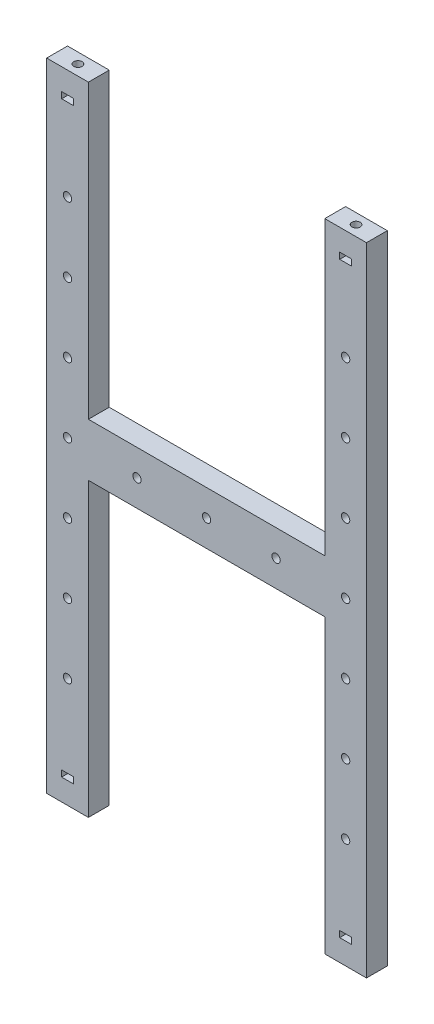
from build123d import *

# Parameters (mm, degrees)
SKETCH_1_R               = 3
EXTRUDE_1_DEPTH          = 15
SKETCH_2_R               = 3
CUT_EXTRUDE_1_DEPTH      = 30
MIRROR_2_COPY_1_SKETCH_R = 3
MIRROR_2_COPY_1_DEPTH    = 30
CUT_EXTRUDE_2_DEPTH      = 4.5
MIRROR_4_COPY_1_DEPTH    = 4.5


with BuildPart() as part:
    # 草图1 → 凸台-拉伸1 (new body)
    with BuildSketch(Plane.XY):
        Polygon((-115, 229), (-115, -229), (-85, -229), (-85, -19), (85, -19), (85, -229), (115, -229), (115, 229), (85, 229), (85, 19), (-85, 19), (-85, 229), align=None)
        Circle(SKETCH_1_R, mode=Mode.SUBTRACT)
        with Locations((50, 0)):
            Circle(SKETCH_1_R, mode=Mode.SUBTRACT)
        with Locations((100, 0)):
            Circle(SKETCH_1_R, mode=Mode.SUBTRACT)
        with Locations((-50, 0)):
            Circle(SKETCH_1_R, mode=Mode.SUBTRACT)
        with Locations((-100, 0)):
            Circle(SKETCH_1_R, mode=Mode.SUBTRACT)
        with Locations((100, 50)):
            Circle(SKETCH_1_R, mode=Mode.SUBTRACT)
        with Locations((100, 100)):
            Circle(SKETCH_1_R, mode=Mode.SUBTRACT)
        with Locations((100, 150)):
            Circle(SKETCH_1_R, mode=Mode.SUBTRACT)
        with Locations((-100, -50)):
            Circle(SKETCH_1_R, mode=Mode.SUBTRACT)
        with Locations((-100, -100)):
            Circle(SKETCH_1_R, mode=Mode.SUBTRACT)
        with Locations((-100, -150)):
            Circle(SKETCH_1_R, mode=Mode.SUBTRACT)
        with Locations((100, -50)):
            Circle(SKETCH_1_R, mode=Mode.SUBTRACT)
        with Locations((100, -100)):
            Circle(SKETCH_1_R, mode=Mode.SUBTRACT)
        with Locations((100, -150)):
            Circle(SKETCH_1_R, mode=Mode.SUBTRACT)
        with Locations((-100, 50)):
            Circle(SKETCH_1_R, mode=Mode.SUBTRACT)
        with Locations((-100, 100)):
            Circle(SKETCH_1_R, mode=Mode.SUBTRACT)
        with Locations((-100, 150)):
            Circle(SKETCH_1_R, mode=Mode.SUBTRACT)
    extrude(amount=EXTRUDE_1_DEPTH)

    # 草图2 → 切除-拉伸1 (cut)
    with BuildSketch(Plane(origin=(0, 229, 0), x_dir=(1, 0, 0), z_dir=(0, 1, 0))):
        with Locations(Location((-100, -7.5, 0), (0, 0, 270))):
            Circle(SKETCH_2_R)
    cut_extrude_1 = extrude(amount=-CUT_EXTRUDE_1_DEPTH, mode=Mode.SUBTRACT)

    # 镜向1: 切除-拉伸1 across plane
    add(cut_extrude_1.mirror(Plane.ZX), mode=Mode.SUBTRACT)

    # 镜向2: 切除-拉伸1 across plane
    add(cut_extrude_1.mirror(Plane(origin=(0, 0, 0), x_dir=(0, 0, 1), z_dir=(1, 0, 0))), mode=Mode.SUBTRACT)

    # 镜向2 copy 1 sketch → 镜向2 copy 1 (cut)
    with BuildSketch(Plane(origin=(0, -229, 0), x_dir=(-1, 0, 0), z_dir=(0, -1, 0))):
        with Locations(Location((-100, -7.5, 0), (0, 0, 270))):
            Circle(MIRROR_2_COPY_1_SKETCH_R)
    extrude(amount=-MIRROR_2_COPY_1_DEPTH, mode=Mode.SUBTRACT)

    # 草图3 → 切除-拉伸2 (cut)
    with BuildSketch(Plane(origin=(0, 209, 0), x_dir=(1, 0, 0), z_dir=(0, 1, 0))):
        Polygon((-104.25, -9.585865128), (-104.25, -15), (-95.75, -15), (-95.75, -9.783166039), (-95.75, -5.046261356), (-100, -2.592522712), (-104.25, -5.046261356), align=None)
    cut_extrude_2 = extrude(amount=CUT_EXTRUDE_2_DEPTH, mode=Mode.SUBTRACT)

    # 镜向3: 切除-拉伸2 across plane
    add(cut_extrude_2.mirror(Plane.ZX), mode=Mode.SUBTRACT)

    # 镜向4: 切除-拉伸2 across plane
    add(cut_extrude_2.mirror(Plane(origin=(0, 0, 0), x_dir=(0, 0, 1), z_dir=(1, 0, 0))), mode=Mode.SUBTRACT)

    # 镜向4 copy 1 sketch → 镜向4 copy 1 (cut)
    with BuildSketch(Plane(origin=(0, -209, 0), x_dir=(-1, 0, 0), z_dir=(0, -1, 0))):
        Polygon((-104.25, -9.585865128), (-104.25, -15), (-95.75, -15), (-95.75, -9.783166039), (-95.75, -5.046261356), (-100, -2.592522712), (-104.25, -5.046261356), align=None)
    extrude(amount=MIRROR_4_COPY_1_DEPTH, mode=Mode.SUBTRACT)


solid = part.part
